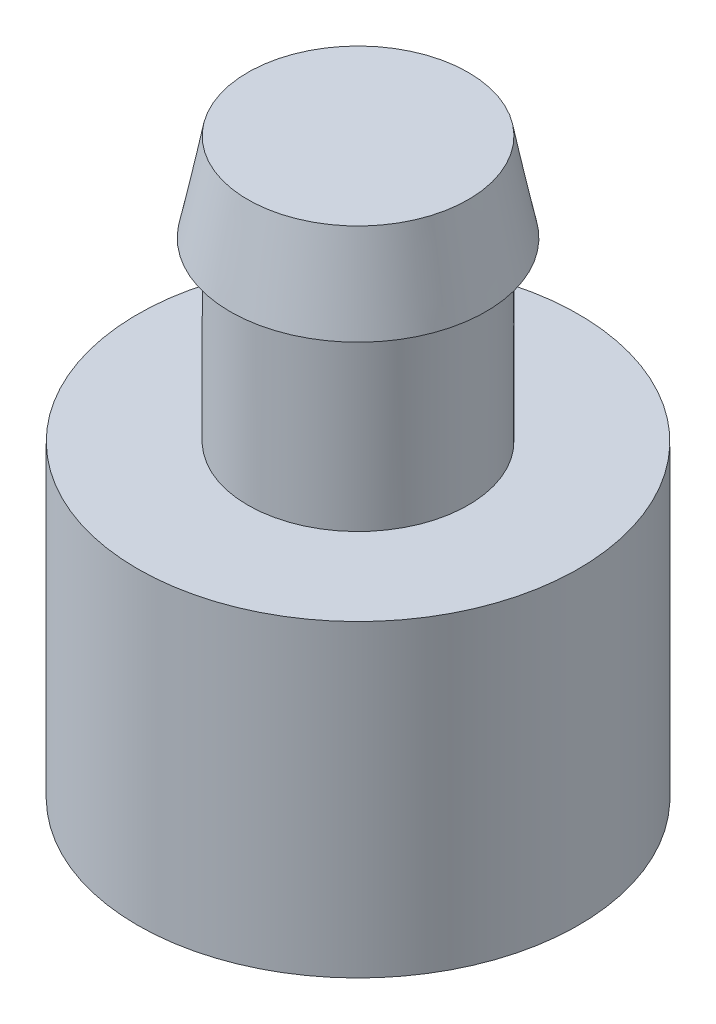
from build123d import *

# Parameters (mm, degrees)
SKETCH1_R           = 2.5
BOSS_EXTRUDE1_DEPTH = 3.5
SKETCH2_R           = 1.25
BOSS_EXTRUDE2_DEPTH = 3


with BuildPart() as part:
    # Sketch1 → Boss-Extrude1 (new body)
    with BuildSketch(Plane(origin=(0, 0, 0), x_dir=(1, 0, 0), z_dir=(0, 1, 0))):
        with Locations(Location((0, 0, 0), (0, 0, 270))):
            Circle(SKETCH1_R)
    extrude(amount=BOSS_EXTRUDE1_DEPTH)

    # Sketch2 → Boss-Extrude2 (add)
    with BuildSketch(Plane(origin=(0, 3.5, 0), x_dir=(1, 0, 0), z_dir=(0, 1, 0))):
        with Locations(Location((0, 0, 0), (0, 0, 270))):
            Circle(SKETCH2_R)
    extrude(amount=BOSS_EXTRUDE2_DEPTH)

    # Sketch3 → Revolve1 (revolve)
    with BuildSketch(Plane.XY, mode=Mode.PRIVATE) as revolve1_sk:
        Polygon((1.25, 6.5), (1.25, 5.5), (1.45, 5.5), align=None)
    revolve(revolve1_sk.sketch.rotate(Axis((0, 0, 0), (0, 1, 0)), 90), axis=Axis((0, 0, 0), (0, 1, 0)))


solid = part.part
